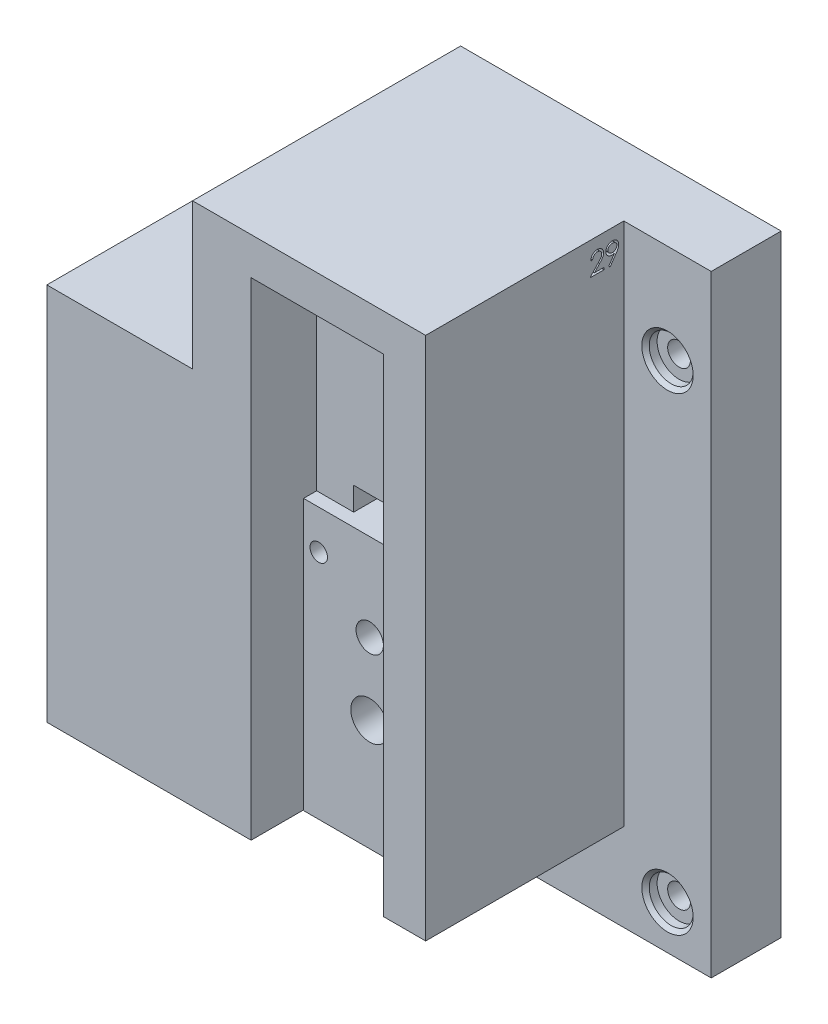
from build123d import *

# Parameters (mm, degrees)
SKETCH1_W                                   = 65
SKETCH1_H                                   = 85
BOSS_EXTRUDE1_DEPTH                         = 46
SKETCH2_W                                   = 25
SKETCH2_H                                   = 20
CUT_EXTRUDE1_DEPTH                          = 46
SKETCH3_W                                   = 22.7
SKETCH3_H                                   = 82.2
CUT_EXTRUDE2_DEPTH                          = 43.2
SKETCH4_R                                   = 3.25
SKETCH4_R_2                                 = 2.35
SKETCH4_R_3                                 = 1.5
SKETCH4_W                                   = 7
SKETCH4_H                                   = 4.8
CUT_EXTRUDE3_DEPTH                          = 29
SKETCH5_W                                   = 22.7
SKETCH5_H                                   = 37.2
CUT_EXTRUDE4_DEPTH                          = 2.25
SKETCH7_R                                   = 3.1
CUT_EXTRUDE5_DEPTH                          = 10
SKETCH10_W                                  = 12
SKETCH10_H                                  = 65
BOSS_EXTRUDE3_DEPTH                         = 15
SKETCH11_R                                  = 3.2
CUT_EXTRUDE6_DEPTH                          = 20
SKETCH12_R                                  = 3.15
CUT_EXTRUDE7_DEPTH                          = 10
SKETCH13_R                                  = 3.1
BOSS_EXTRUDE5_DEPTH                         = 10
SKETCH14_W                                  = 80
SKETCH14_H                                  = 12
BOSS_EXTRUDE6_DEPTH                         = 15
SKETCH15_W                                  = 12
SKETCH15_H                                  = 100
BOSS_EXTRUDE8_DEPTH                         = 15
SKETCH16_W                                  = 15
SKETCH16_H                                  = 80
CUT_EXTRUDE8_DEPTH                          = 15
CBORE_FOR_5_BINDING_HEAD_MACHINE_SC_2_COUNT = 2
CBORE_FOR_5_BINDING_HEAD_MACHINE_SC_2_PITCH = 80.5
CBORE_FOR_5_BINDING_HEAD_MACHINE_SC_3_COUNT = 2
CBORE_FOR_5_BINDING_HEAD_MACHINE_SC_3_PITCH = 100.700049652
SKETCH20_R                                  = 3.15
BOSS_EXTRUDE9_DEPTH                         = 10
SKETCH24_W                                  = 22.7
SKETCH24_H                                  = 43.2
CUT_EXTRUDE10_DEPTH                         = 1.5
SKETCH28_W                                  = 22.7
SKETCH28_H                                  = 83.6
CUT_EXTRUDE14_DEPTH                         = 20
BOSS_EXTRUDE10_DEPTH                        = 5
SKETCH30_W                                  = 22.7
SKETCH30_H                                  = 83.7
BOSS_EXTRUDE11_DEPTH                        = 37
SKETCH32_R                                  = 3.25
SKETCH32_R_2                                = 2.35
SKETCH32_R_3                                = 1.5
CUT_EXTRUDE15_DEPTH                         = 53.45
SKETCH33_W                                  = 22.7
SKETCH33_H                                  = 37.3
CUT_EXTRUDE16_DEPTH                         = 2.25
CUT_EXTRUDE17_DEPTH                         = 62.25
SKETCH36_W                                  = 16.528800681
SKETCH36_H                                  = 4.182136134
CUT_EXTRUDE22_DEPTH                         = 60
CUT_EXTRUDE23_DEPTH                         = 2


with BuildPart() as part:
    # Sketch1 → Boss-Extrude1 (new body)
    with BuildSketch(Plane.XY):
        with Locations((-32.5, -42.5)):
            Rectangle(SKETCH1_W, SKETCH1_H)
    extrude(amount=BOSS_EXTRUDE1_DEPTH)

    # Sketch2 → Cut-Extrude1 (cut)
    with BuildSketch(Plane.XY.offset(46)):
        with Locations((-52.5, -10)):
            Rectangle(SKETCH2_W, SKETCH2_H)
    extrude(amount=-CUT_EXTRUDE1_DEPTH, mode=Mode.SUBTRACT)

    # Sketch3 → Cut-Extrude2 (cut)
    with BuildSketch(Plane(origin=(0, 0, 0), x_dir=(-1, 0, 0), z_dir=(0, 0, -1))):
        with Locations((18.6, -42.5)):
            Rectangle(SKETCH3_W, SKETCH3_H)
    extrude(amount=-CUT_EXTRUDE2_DEPTH, mode=Mode.SUBTRACT)

    # Sketch4 → Cut-Extrude3 (cut)
    with BuildSketch(Plane(origin=(0, 0, 43.2), x_dir=(-1, 0, 0), z_dir=(0, 0, -1))):
        with Locations((20, -65.9)):
            Circle(SKETCH4_R)
        with Locations((20, -53.6)):
            Circle(SKETCH4_R_2)
        with Locations((11.25, -45.3)):
            Circle(SKETCH4_R_3)
        with Locations((25.95, -45.3)):
            Circle(SKETCH4_R_3)
        with Locations((20, -31.93)):
            Rectangle(SKETCH4_W, SKETCH4_H)
    extrude(amount=-CUT_EXTRUDE3_DEPTH, mode=Mode.SUBTRACT)

    # Sketch5 → Cut-Extrude4 (cut)
    with BuildSketch(Plane(origin=(0, 0, 43.2), x_dir=(-1, 0, 0), z_dir=(0, 0, -1))):
        with Locations((18.6, -20)):
            Rectangle(SKETCH5_W, SKETCH5_H)
    extrude(amount=-CUT_EXTRUDE4_DEPTH, mode=Mode.SUBTRACT)

    # Sketch7 → Cut-Extrude5 (cut)
    with BuildSketch(Plane(origin=(0, -20, 0), x_dir=(1, 0, 0), z_dir=(0, 1, 0))):
        with Locations(Location((-52.5, -11, 0), (0, 0, 270))):
            Circle(SKETCH7_R)
    extrude(amount=-CUT_EXTRUDE5_DEPTH, mode=Mode.SUBTRACT)

    # Sketch10 → Boss-Extrude3 (add)
    with BuildSketch(Plane.ZY.offset(65)):
        with Locations((6, -52.5)):
            Rectangle(SKETCH10_W, SKETCH10_H)
    extrude(amount=BOSS_EXTRUDE3_DEPTH)

    # Sketch11 → Cut-Extrude6 (cut)
    with BuildSketch(Plane.ZY.offset(65)):
        with Locations((35, -65)):
            Circle(SKETCH11_R)
    extrude(amount=-CUT_EXTRUDE6_DEPTH, mode=Mode.SUBTRACT)

    # Sketch12 → Cut-Extrude7 (cut)
    with BuildSketch(Plane(origin=(0, -20, 0), x_dir=(1, 0, 0), z_dir=(0, 1, 0))):
        with Locations(Location((-52.5, -35, 0), (0, 0, 270))):
            Circle(SKETCH12_R)
    extrude(amount=-CUT_EXTRUDE7_DEPTH, mode=Mode.SUBTRACT)

    # Sketch13 → Boss-Extrude5 (add)
    with BuildSketch(Plane(origin=(0, -20, 0), x_dir=(1, 0, 0), z_dir=(0, 1, 0))):
        with Locations((-52.5, -11)):
            Circle(SKETCH13_R)
    extrude(amount=-BOSS_EXTRUDE5_DEPTH)

    # Sketch14 → Boss-Extrude6 (add)
    with BuildSketch(Plane.XZ.offset(85)):
        with Locations((-40, 6)):
            Rectangle(SKETCH14_W, SKETCH14_H)
    extrude(amount=BOSS_EXTRUDE6_DEPTH)

    # Sketch15 → Boss-Extrude8 (add)
    with BuildSketch(Plane(origin=(0, 0, 0), x_dir=(0, 0, -1), z_dir=(1, 0, 0))):
        with Locations((-6, -50)):
            Rectangle(SKETCH15_W, SKETCH15_H)
    extrude(amount=BOSS_EXTRUDE8_DEPTH)

    # Sketch16 → Cut-Extrude8 (cut)
    with BuildSketch(Plane.XY.offset(12)):
        with Locations((-72.5, -60)):
            Rectangle(SKETCH16_W, SKETCH16_H)
    extrude(amount=-CUT_EXTRUDE8_DEPTH, mode=Mode.SUBTRACT)

    # Sketch19 → CBORE for #5 Binding Head Machine Screw1 (revolve, cut)
    with BuildSketch(Plane(origin=(7.5, -12, 12), x_dir=(0, -1, 0), z_dir=(1, 0, 0))):
        Polygon((0, 0), (0, 12), (1.9558, 12), (1.9558, 1.9812), (3.77063, 1.9812), (3.77063, 0.635), (4.40563, 0), align=None)
    cbore_for_5_binding_head_machine_screw1 = revolve(axis=Axis((7.5, -12, 18.35), (0, 0, -1)), mode=Mode.SUBTRACT)

    # CBORE for _5 Binding Head Machine Sc 2: CBORE for #5 Binding Head Machine Screw1 ×2
    with Locations(*[(0, -i * CBORE_FOR_5_BINDING_HEAD_MACHINE_SC_2_PITCH, 0) for i in range(1, CBORE_FOR_5_BINDING_HEAD_MACHINE_SC_2_COUNT)]):
        add(cbore_for_5_binding_head_machine_screw1, mode=Mode.SUBTRACT)

    # CBORE for _5 Binding Head Machine Sc 3: CBORE for #5 Binding Head Machine Screw1 ×2
    with Locations(*[Vector(-0.6007941426923182, -0.7994037766401922, 0) * (i * CBORE_FOR_5_BINDING_HEAD_MACHINE_SC_3_PITCH) for i in range(1, CBORE_FOR_5_BINDING_HEAD_MACHINE_SC_3_COUNT)]):
        add(cbore_for_5_binding_head_machine_screw1, mode=Mode.SUBTRACT)

    # Sketch20 → Boss-Extrude9 (add)
    with BuildSketch(Plane(origin=(0, -20, 0), x_dir=(1, 0, 0), z_dir=(0, 1, 0))):
        with Locations((-52.5, -35)):
            Circle(SKETCH20_R)
    extrude(amount=-BOSS_EXTRUDE9_DEPTH)

    # Sketch24 → Cut-Extrude10 (cut)
    with BuildSketch(Plane(origin=(0, -83.6, 0), x_dir=(1, 0, 0), z_dir=(0, 1, 0))):
        with Locations((-18.6, -21.6)):
            Rectangle(SKETCH24_W, SKETCH24_H)
    extrude(amount=-CUT_EXTRUDE10_DEPTH, mode=Mode.SUBTRACT)

    # Sketch28 → Cut-Extrude14 (cut)
    with BuildSketch(Plane(origin=(0, 0, 43.2), x_dir=(-1, 0, 0), z_dir=(0, 0, -1))):
        with Locations((18.6, -43.2)):
            Rectangle(SKETCH28_W, SKETCH28_H)
    extrude(amount=-CUT_EXTRUDE14_DEPTH, mode=Mode.SUBTRACT)

    # Sketch29 → Boss-Extrude10 (add)
    with BuildSketch(Plane(origin=(0, 0, 0), x_dir=(1, 0, 0), z_dir=(0, 1, 0))):
        Polygon((-40, 0), (15, 0), (15, -12), (0, -12), (0, -46), (-40, -46), align=None)
    extrude(amount=BOSS_EXTRUDE10_DEPTH)

    # Sketch30 → Boss-Extrude11 (add)
    with BuildSketch(Plane.XY):
        with Locations((-18.6, -43.25)):
            Rectangle(SKETCH30_W, SKETCH30_H)
    extrude(amount=BOSS_EXTRUDE11_DEPTH)

    # Sketch32 → Cut-Extrude15 (cut)
    with BuildSketch(Plane.XY.offset(37)):
        with Locations((-18.6, -66)):
            Circle(SKETCH32_R)
        with Locations((-18.6, -53.7)):
            Circle(SKETCH32_R_2)
        with Locations((-27.35, -45.4)):
            Circle(SKETCH32_R_3)
        with Locations((-9.85, -45.4)):
            Circle(SKETCH32_R_3)
    extrude(amount=-CUT_EXTRUDE15_DEPTH, mode=Mode.SUBTRACT)

    # Sketch33 → Cut-Extrude16 (cut)
    with BuildSketch(Plane.XY.offset(37)):
        with Locations((-18.6, -20.05)):
            Rectangle(SKETCH33_W, SKETCH33_H)
    extrude(amount=-CUT_EXTRUDE16_DEPTH, mode=Mode.SUBTRACT)

    # Sketch34 → Cut-Extrude17 (cut)
    with BuildSketch(Plane.XY.offset(34.75)):
        Polygon((-23.6, -34.7), (-18.6, -34.7), (-13.6, -34.7), (-13.6, -38.7), (-23.6, -38.7), align=None)
    extrude(amount=-CUT_EXTRUDE17_DEPTH, mode=Mode.SUBTRACT)

    # Sketch36 → Cut-Extrude22 (cut)
    with BuildSketch(Plane(origin=(15, 0, 0), x_dir=(0, 0, -1), z_dir=(1, 0, 0))):
        with Locations((-20.264400341, -87.091068067)):
            Rectangle(SKETCH36_W, SKETCH36_H)
    extrude(amount=-CUT_EXTRUDE22_DEPTH, mode=Mode.SUBTRACT)

    # Sketch37 → Cut-Extrude23 (cut)
    # profile 1 of 2: a face of its own
    with BuildSketch(Plane(origin=(0, 0, 0), x_dir=(0, 0, -1), z_dir=(1, 0, 0))):
        with BuildLine():
            Line((-17.353810105, 1.869565039), (-17.667912669, 1.869565039))
            add(Edge.make_bspline(
                [(-17.667912669, 1.869565039), (-17.665865516, 1.911235927), (-17.661844962, 1.993076442), (-17.643016673, 2.112400348), (-17.616075796, 2.226455147), (-17.577984342, 2.334325061), (-17.530678064, 2.436963868), (-17.473948037, 2.533963884), (-17.406754186, 2.624955072), (-17.330547452, 2.709093916), (-17.247778813, 2.786281486), (-17.158472873, 2.852936729), (-17.064627846, 2.909254401), (-16.966528447, 2.956335642), (-16.863067884, 2.991675488), (-16.755185026, 3.017897128), (-16.642405889, 3.033673474), (-16.565565867, 3.035369259), (-16.526486387, 3.036231706)],
                knots=[0, 0, 0, 0, 1.10065271, 2.161652631, 3.183658789, 4.190468796, 5.17591951, 6.163126047, 7.15150782, 8.156236427, 9.156009102, 10.134482811, 11.092018607, 12.041330605, 13.001268258, 13.972401359, 14.968799086, 16, 16, 16, 16], degree=3))
            add(Edge.make_bspline(
                [(-16.526486387, 3.036231706), (-16.488108313, 3.03533325), (-16.412696768, 3.033567815), (-16.302634754, 3.018406785), (-16.19785746, 2.994661194), (-16.098569693, 2.961345777), (-16.005563628, 2.91656135), (-15.918140584, 2.862763811), (-15.835259773, 2.80054398), (-15.760652989, 2.727290167), (-15.69214491, 2.649087782), (-15.633042655, 2.565599879), (-15.582429492, 2.479370593), (-15.540241812, 2.389742391), (-15.509185673, 2.295871363), (-15.485607465, 2.19912416), (-15.472280051, 2.098499349), (-15.470234628, 2.030392793), (-15.46919472, 1.995766962)],
                knots=[0, 0, 0, 0, 1.111607364, 2.184268762, 3.212621178, 4.221274766, 5.211760367, 6.196651075, 7.1921475, 8.207485113, 9.220403448, 10.201281604, 11.166441695, 12.114753415, 13.065576456, 14.026450734, 14.996634279, 16, 16, 16, 16], degree=3))
            add(Edge.make_bspline(
                [(-15.46919472, 1.995766962), (-15.470887983, 1.947019128), (-15.474244795, 1.850378914), (-15.502959171, 1.708364051), (-15.547805682, 1.570770632), (-15.601803039, 1.46003333), (-15.656275483, 1.370799836), (-15.705362991, 1.297331132), (-15.762827802, 1.218225663), (-15.8295063, 1.133748326), (-15.904019172, 1.043237421), (-15.987041335, 0.946747625), (-16.079164817, 0.845275855), (-16.143823318, 0.775970254), (-16.177327733, 0.740057828)],
                knots=[0, 0, 0, 0, 1.184426356, 2.348067706, 3.509069118, 4.696110526, 5.333549288, 6.050745305, 6.844228056, 7.710549037, 8.667450064, 9.695053472, 10.805634456, 12, 12, 12, 12], degree=3))
            Line((-16.177327733, 0.740057828), (-17.053028855, -0.194537525))
            Line((-17.053028855, -0.194537525), (-15.424322926, -0.194537525))
            Line((-15.424322926, -0.194537525), (-15.424322926, -0.553511884))
            Line((-15.424322926, -0.553511884), (-17.802528054, -0.553511884))
            Line((-17.802528054, -0.553511884), (-16.445156259, 0.895005744))
            add(Edge.make_bspline(
                [(-16.445156259, 0.895005744), (-16.412108372, 0.929504051), (-16.348630145, 0.995768238), (-16.258847568, 1.092511198), (-16.17820858, 1.182260738), (-16.106191187, 1.264847287), (-16.044357682, 1.341478855), (-15.98948545, 1.409673558), (-15.945519859, 1.472428009), (-15.897804463, 1.545168623), (-15.851590482, 1.63398094), (-15.811878126, 1.742514629), (-15.787663277, 1.854241882), (-15.784758442, 1.929743919), (-15.783297285, 1.967722091)],
                knots=[0, 0, 0, 0, 1.329631726, 2.553950428, 3.673215718, 4.687767853, 5.603093632, 6.413772471, 7.123043292, 7.734684054, 8.834405432, 9.900288307, 10.943827018, 12, 12, 12, 12], degree=3))
            add(Edge.make_bspline(
                [(-15.783297285, 1.967722091), (-15.783933027, 1.991603489), (-15.785185953, 2.038669139), (-15.79624365, 2.107674898), (-15.812954156, 2.174239712), (-15.836899415, 2.238568331), (-15.868506155, 2.300013983), (-15.906979535, 2.358651464), (-15.951369598, 2.415340429), (-16.002720867, 2.468493727), (-16.059132387, 2.517174932), (-16.118726637, 2.560299018), (-16.181776741, 2.596338129), (-16.248016863, 2.625881626), (-16.317262333, 2.649057007), (-16.389647078, 2.665115586), (-16.464971094, 2.67519807), (-16.51640459, 2.676562242), (-16.542612188, 2.677257347)],
                knots=[0, 0, 0, 0, 0.991446411, 1.95395049, 2.89581595, 3.838931463, 4.798493298, 5.75982156, 6.748411868, 7.785213223, 8.824556874, 9.840280684, 10.836137867, 11.835679398, 12.848801643, 13.863922112, 14.911575587, 16, 16, 16, 16], degree=3))
            add(Edge.make_bspline(
                [(-16.542612188, 2.677257347), (-16.569983021, 2.676542315), (-16.623734817, 2.675138109), (-16.70265385, 2.665315445), (-16.777939628, 2.648369605), (-16.849781531, 2.625192931), (-16.918301117, 2.595734382), (-16.983165161, 2.559042637), (-17.04422805, 2.515259144), (-17.101604573, 2.465618588), (-17.154468552, 2.410350986), (-17.200915428, 2.348741023), (-17.241499442, 2.281913608), (-17.276908676, 2.210049057), (-17.305664366, 2.132495277), (-17.327637516, 2.049527573), (-17.345024363, 1.961506191), (-17.350832884, 1.900721106), (-17.353810105, 1.869565039)],
                knots=[0, 0, 0, 0, 1.031018746, 2.02475058, 2.990194455, 3.934040569, 4.864654155, 5.795059489, 6.735614925, 7.690564532, 8.649604399, 9.611025574, 10.590972636, 11.591080095, 12.624614302, 13.701020113, 14.821632451, 16, 16, 16, 16], degree=3))
        make_face()
    # profile 2 of 2: a face of its own
    with BuildSketch(Plane(origin=(0, 0, 0), x_dir=(0, 0, -1), z_dir=(1, 0, 0))):
        with BuildLine():
            Line((-14.347399849, -0.643255474), (-14.598401451, -0.468676147))
            Line((-14.598401451, -0.468676147), (-13.6252444, 0.953899975))
            add(Edge.make_bspline(
                [(-13.6252444, 0.953899975), (-13.687335136, 0.946306912), (-13.809595256, 0.931355747), (-13.932732358, 0.928609092), (-13.993333342, 0.927257347)],
                knots=[0, 0, 0, 0, 1.015715272, 2, 2, 2, 2], degree=3))
            add(Edge.make_bspline(
                [(-13.993333342, 0.927257347), (-14.03007539, 0.928198423), (-14.102196817, 0.930045674), (-14.208228469, 0.944687483), (-14.31011403, 0.96723761), (-14.407583386, 1.000886365), (-14.501002891, 1.042704574), (-14.590168604, 1.094561588), (-14.674960495, 1.15556788), (-14.754467905, 1.225400871), (-14.826779644, 1.302078924), (-14.891202941, 1.383234567), (-14.944744073, 1.469810537), (-14.989220659, 1.560040757), (-15.022951112, 1.655222108), (-15.04751365, 1.754271508), (-15.062636004, 1.85788315), (-15.0644351, 1.92840828), (-15.065348567, 1.964216482)],
                knots=[0, 0, 0, 0, 1.060718605, 2.082097864, 3.085795603, 4.069760067, 5.054557537, 6.03741023, 7.043284206, 8.066802108, 9.088538119, 10.083643548, 11.053783639, 12.022749082, 12.983451788, 13.964007469, 14.966251758, 16, 16, 16, 16], degree=3))
            add(Edge.make_bspline(
                [(-15.065348567, 1.964216482), (-15.063614132, 2.013185134), (-15.060209788, 2.109300666), (-15.032811271, 2.249734435), (-14.987750932, 2.382520979), (-14.924922555, 2.507311172), (-14.845787834, 2.622309912), (-14.750679243, 2.725918521), (-14.640175279, 2.816663375), (-14.51679326, 2.894667452), (-14.383440239, 2.957402449), (-14.243771581, 3.00364175), (-14.098857461, 3.030840498), (-14.000689791, 3.034426359), (-13.951266035, 3.036231706)],
                knots=[0, 0, 0, 0, 1.022988612, 2.007919123, 2.978103895, 3.94594894, 4.918897164, 5.887013414, 6.875921846, 7.89917871, 8.930658928, 9.948724884, 10.967259574, 12, 12, 12, 12], degree=3))
            add(Edge.make_bspline(
                [(-13.951266035, 3.036231706), (-13.902777615, 3.034401543), (-13.806969068, 3.030785313), (-13.666080062, 3.004301344), (-13.531139045, 2.959664671), (-13.402894058, 2.897980108), (-13.284154646, 2.8206592), (-13.177378835, 2.728524676), (-13.085003295, 2.621519149), (-13.007179415, 2.502230659), (-12.944709374, 2.374063678), (-12.899637091, 2.240279755), (-12.871891452, 2.101841034), (-12.868395125, 2.00804656), (-12.866630618, 1.960710873)],
                knots=[0, 0, 0, 0, 1.026385292, 2.028040595, 3.023318987, 4.028184125, 5.03290303, 6.015178782, 7.004435299, 8.016004309, 9.023023918, 10.015172535, 10.998308025, 12, 12, 12, 12], degree=3))
            add(Edge.make_bspline(
                [(-12.866630618, 1.960710873), (-12.867809027, 1.923967105), (-12.870199135, 1.849441565), (-12.886935442, 1.736211222), (-12.915355627, 1.620759992), (-12.947607326, 1.523038397), (-12.978739493, 1.442329947), (-13.008040625, 1.378578367), (-13.040552779, 1.311477104), (-13.078471544, 1.241729766), (-13.119233841, 1.168447231), (-13.165293117, 1.092364515), (-13.215598689, 1.013379522), (-13.251428409, 0.960132434), (-13.26977565, 0.932866321)],
                knots=[0, 0, 0, 0, 1.179839688, 2.393009684, 3.667231171, 4.993948276, 5.694988576, 6.444077775, 7.246288328, 8.089075292, 8.993003841, 9.939041771, 10.944649915, 12, 12, 12, 12], degree=3))
            Line((-13.26977565, 0.932866321), (-14.347399849, -0.643255474))
        make_face()
        with BuildLine():
            add(Edge.make_bspline(
                [(-13.935140233, 1.286231706), (-13.907306219, 1.28699209), (-13.853122856, 1.288472298), (-13.773745557, 1.29748154), (-13.698821354, 1.313455526), (-13.628150104, 1.336375238), (-13.561023202, 1.364031907), (-13.498506874, 1.399243893), (-13.440548799, 1.441260528), (-13.386760872, 1.488470544), (-13.338996872, 1.540921128), (-13.296453842, 1.595818234), (-13.260293274, 1.653402844), (-13.231729997, 1.714396107), (-13.208245422, 1.777313315), (-13.19202741, 1.84316767), (-13.183043076, 1.911616071), (-13.181511501, 1.958114729), (-13.180733182, 1.981744526)],
                knots=[0, 0, 0, 0, 1.163407946, 2.26475976, 3.333800367, 4.359385343, 5.366239384, 6.363380779, 7.350133999, 8.353570782, 9.349036268, 10.310270964, 11.253520213, 12.184142, 13.120487599, 14.056272588, 15.012232024, 16, 16, 16, 16], degree=3))
            add(Edge.make_bspline(
                [(-13.180733182, 1.981744526), (-13.181402851, 2.005384192), (-13.182722516, 2.051969052), (-13.193309816, 2.120518792), (-13.211935039, 2.186212052), (-13.236925524, 2.249408482), (-13.269845762, 2.309588854), (-13.309349248, 2.367508726), (-13.356281697, 2.422800854), (-13.410284264, 2.474164837), (-13.468518817, 2.521512737), (-13.530579317, 2.563298813), (-13.595954233, 2.598320009), (-13.664244723, 2.627218979), (-13.735593072, 2.649770754), (-13.80995706, 2.665988119), (-13.887712465, 2.674959874), (-13.940493751, 2.676481768), (-13.967391836, 2.677257347)],
                knots=[0, 0, 0, 0, 0.972161553, 1.915763587, 2.844109794, 3.775983486, 4.705125789, 5.659731448, 6.655561913, 7.682237399, 8.721216875, 9.739758359, 10.754845918, 11.767244016, 12.7857855, 13.828538656, 14.893392813, 16, 16, 16, 16], degree=3))
            add(Edge.make_bspline(
                [(-13.967391836, 2.677257347), (-13.994055989, 2.676480515), (-14.046370839, 2.674956378), (-14.123434998, 2.666005173), (-14.197296166, 2.649661689), (-14.268437786, 2.627229425), (-14.336726247, 2.598317853), (-14.402098079, 2.563296977), (-14.464173096, 2.521522355), (-14.522351817, 2.474127583), (-14.576449739, 2.423039937), (-14.622575268, 2.367266508), (-14.66216916, 2.309618983), (-14.695044163, 2.249400475), (-14.72004668, 2.186214189), (-14.738668682, 2.120518213), (-14.749256847, 2.051969203), (-14.750576394, 2.005384242), (-14.751246003, 1.981744526)],
                knots=[0, 0, 0, 0, 1.099389452, 2.15699305, 3.192601482, 4.213358962, 5.227959689, 6.245255729, 7.266013209, 8.307253147, 9.336162325, 10.327954924, 11.284637477, 12.215801273, 13.149702402, 14.080068371, 15.025723358, 16, 16, 16, 16], degree=3))
            add(Edge.make_bspline(
                [(-14.751246003, 1.981744526), (-14.750640076, 1.958096328), (-14.749445079, 1.911457752), (-14.73791729, 1.842931359), (-14.71863901, 1.777243165), (-14.692819619, 1.713754458), (-14.658818029, 1.6530826), (-14.617094181, 1.595515238), (-14.568188635, 1.540399787), (-14.512755147, 1.488592576), (-14.452086986, 1.4410404), (-14.38729024, 1.399510018), (-14.319480403, 1.364437574), (-14.248418773, 1.33629619), (-14.174631973, 1.313684526), (-14.097456841, 1.297510981), (-14.017148604, 1.288558714), (-13.962738622, 1.287014817), (-13.935140233, 1.286231706)],
                knots=[0, 0, 0, 0, 0.952633368, 1.87876736, 2.791047057, 3.707742249, 4.635551637, 5.587206343, 6.568248508, 7.601284464, 8.641511608, 9.671105535, 10.699146789, 11.713763218, 12.747829548, 13.806491675, 14.887386225, 16, 16, 16, 16], degree=3))
        make_face(mode=Mode.SUBTRACT)
    extrude(amount=-CUT_EXTRUDE23_DEPTH, mode=Mode.SUBTRACT)


solid = part.part
